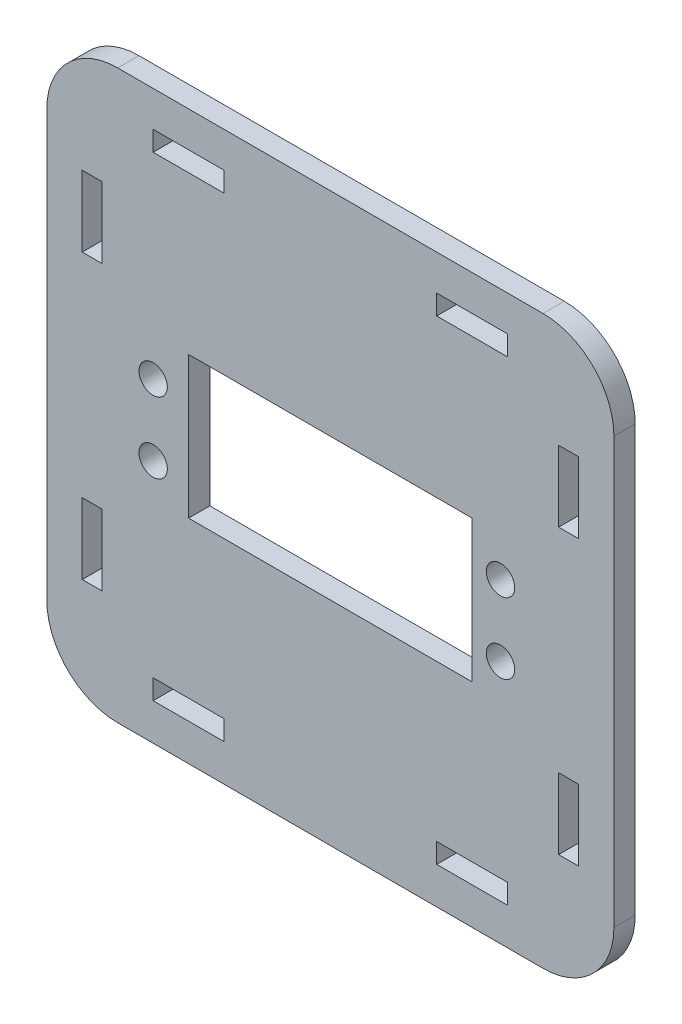
from build123d import *

# Parameters (mm, degrees)
BOSS_EXTRU_1_DEPTH      = 3
ESQUISSE4_W             = 10
ESQUISSE4_H             = 2.8
ENL_V_MAT_EXTRU_2_DEPTH = 114.176852757
ESQUISSE5_W             = 2.8
ESQUISSE5_H             = 10
ENL_V_MAT_EXTRU_3_DEPTH = 114.176852757
ESQUISSE6_W             = 40
ESQUISSE6_H             = 20
ENL_V_MAT_EXTRU_4_DEPTH = 114.176852757
ESQUISSE7_R             = 2
ENL_V_MAT_EXTRU_5_DEPTH = 114.176852757


with BuildPart() as part:
    # Esquisse2 → Boss.-Extru.1 (new body)
    with BuildSketch(Plane.XY):
        with BuildLine():
            Line((10, 0), (70, 0))
            ThreePointArc((70, 0), (77.071067812, 2.928932188), (80, 10))
            Line((80, 10), (80, 70))
            ThreePointArc((80, 70), (77.071067812, 77.071067812), (70, 80))
            Line((70, 80), (10, 80))
            ThreePointArc((10, 80), (2.928932188, 77.071067812), (0, 70))
            Line((0, 70), (0, 10))
            ThreePointArc((0, 10), (2.928932188, 2.928932188), (10, 0))
        make_face()
    extrude(amount=BOSS_EXTRU_1_DEPTH)

    # Esquisse4 → Enlèv. mat.-Extru.2 (cut, through all)
    with BuildSketch(Plane.XY.offset(3)):
        with Locations((60, 73.6)):
            Rectangle(ESQUISSE4_W, ESQUISSE4_H)
        with Locations((20, 73.6)):
            Rectangle(ESQUISSE4_W, ESQUISSE4_H)
        with Locations((20, 6.6)):
            Rectangle(ESQUISSE4_W, ESQUISSE4_H)
        with Locations((60, 6.6)):
            Rectangle(ESQUISSE4_W, ESQUISSE4_H)
    extrude(amount=-ENL_V_MAT_EXTRU_2_DEPTH, mode=Mode.SUBTRACT)

    # Esquisse5 → Enlèv. mat.-Extru.3 (cut, through all)
    with BuildSketch(Plane.XY.offset(3)):
        with Locations((73.6, 60)):
            Rectangle(ESQUISSE5_W, ESQUISSE5_H)
        with Locations((6.4, 60)):
            Rectangle(ESQUISSE5_W, ESQUISSE5_H)
        with Locations((6.4, 20)):
            Rectangle(ESQUISSE5_W, ESQUISSE5_H)
        with Locations((73.6, 20)):
            Rectangle(ESQUISSE5_W, ESQUISSE5_H)
    extrude(amount=-ENL_V_MAT_EXTRU_3_DEPTH, mode=Mode.SUBTRACT)

    # Esquisse6 → Enlèv. mat.-Extru.4 (cut, through all)
    with BuildSketch(Plane.XY.offset(3)):
        with Locations((40, 40)):
            Rectangle(ESQUISSE6_W, ESQUISSE6_H)
    extrude(amount=-ENL_V_MAT_EXTRU_4_DEPTH, mode=Mode.SUBTRACT)

    # Esquisse7 → Enlèv. mat.-Extru.5 (cut, through all)
    with BuildSketch(Plane(origin=(0, 0, 0), x_dir=(-1, 0, 0), z_dir=(0, 0, -1))):
        with Locations((-15, 34.5)):
            Circle(ESQUISSE7_R)
        with Locations((-15, 44.5)):
            Circle(ESQUISSE7_R)
        with Locations((-64, 34.5)):
            Circle(ESQUISSE7_R)
        with Locations((-64, 44.5)):
            Circle(ESQUISSE7_R)
    extrude(amount=-ENL_V_MAT_EXTRU_5_DEPTH, mode=Mode.SUBTRACT)


solid = part.part
